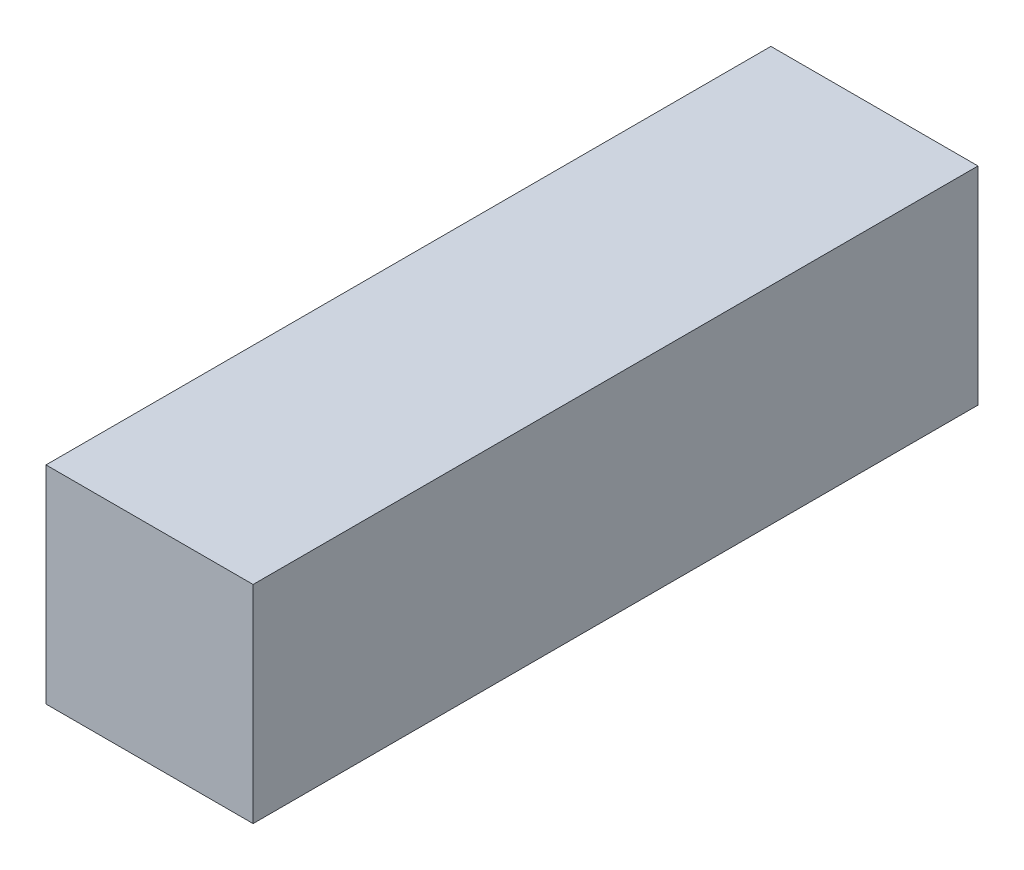
from build123d import *

# Parameters (mm, degrees)
BOSS_EXTRUDE1_DEPTH      = 7
BOSS_EXTRUDE1_DEPTH_BACK = 7
SKETCH3_W                = 4
SKETCH3_H                = 4


with BuildPart() as part:
    # Sketch3 → Boss-Extrude1 (new, two sides: drawn at the far end of the back side and taken through both)
    with BuildSketch(Plane.XY.offset(-BOSS_EXTRUDE1_DEPTH_BACK)):
        Rectangle(SKETCH3_W, SKETCH3_H)
    extrude(amount=BOSS_EXTRUDE1_DEPTH + BOSS_EXTRUDE1_DEPTH_BACK)


solid = part.part
